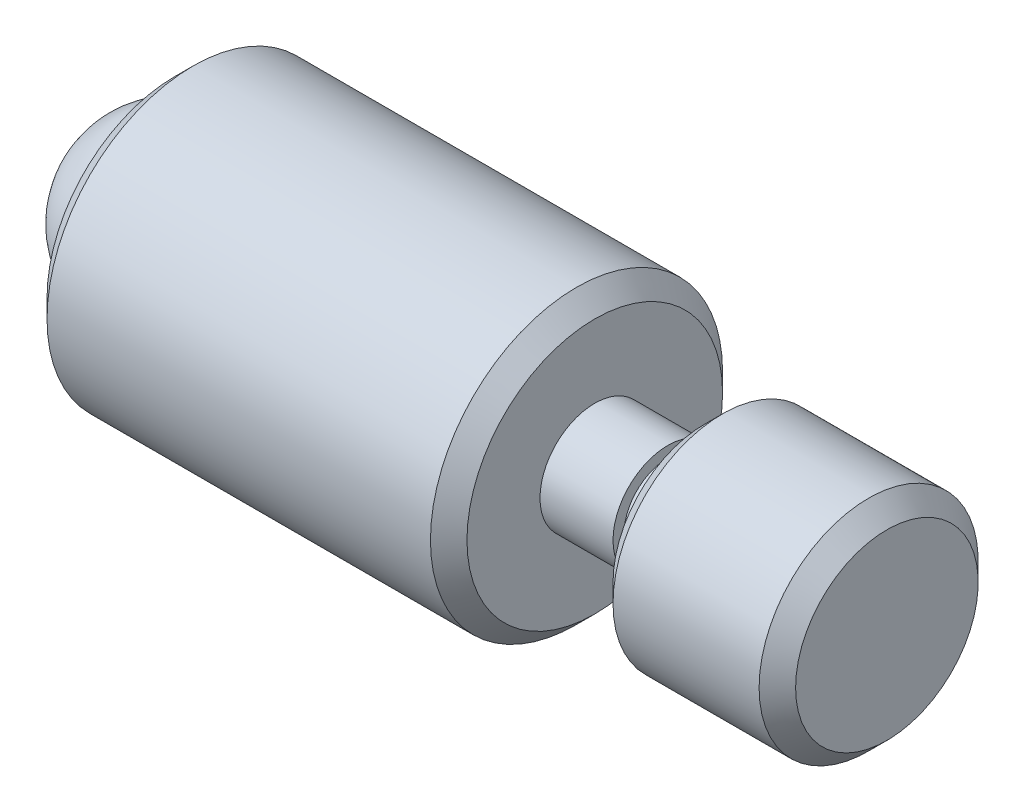
from build123d import *


with BuildPart() as part:
    # 草图1 → 旋转1 (revolve)
    with BuildSketch(Plane.XY):
        with BuildLine():
            Line((2.5, 2.5), (2.5, 3.5))
            Line((2.5, 3.5), (3, 4))
            Line((3, 4), (13.5, 4))
            Line((13.5, 4), (14, 3.5))
            Line((14, 3.5), (14, 1.5))
            Line((14, 1.5), (16, 1.5))
            Line((16, 1.5), (16, 1.2))
            Line((16, 1.2), (17, 1.2))
            Line((17, 1.2), (17, 2.5))
            Line((17, 2.5), (17.5, 3))
            Line((17.5, 3), (21.5, 3))
            Line((21.5, 3), (22, 2.5))
            Line((22, 2.5), (22, 0))
            Line((22, 0), (0, 0))
            ThreePointArc((0, 0), (0.732233047, 1.767766953), (2.5, 2.5))
        make_face()
    revolve(axis=Axis((22, 0, 0), (-1, 0, 0)))


solid = part.part
